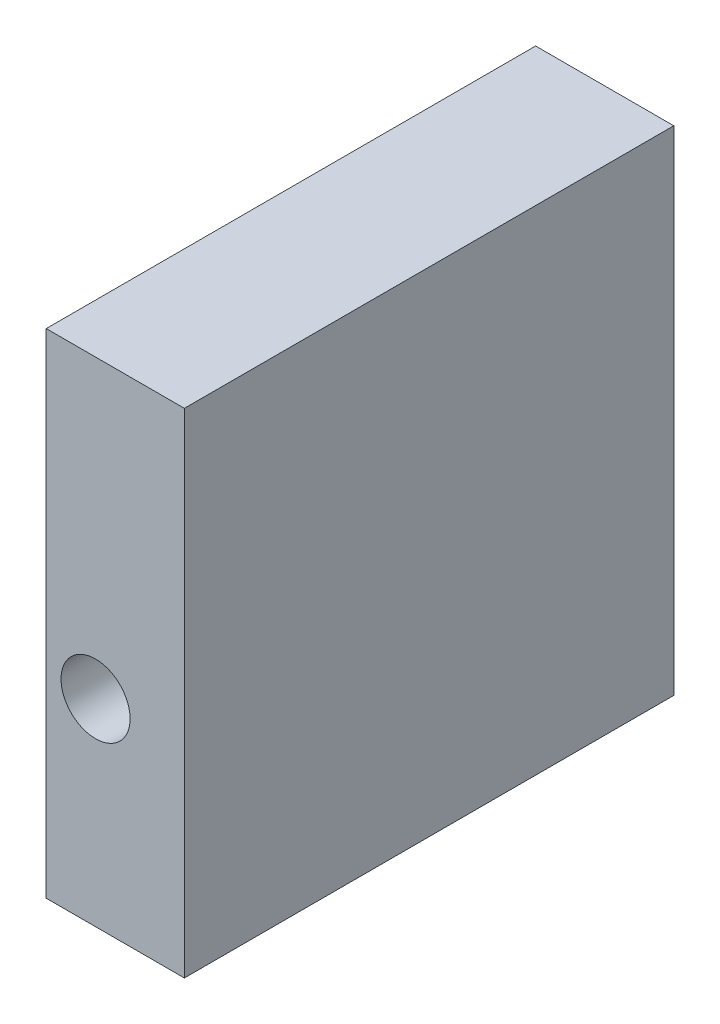
from build123d import *

# Parameters (mm, degrees)
SKETCH1_W           = 7
SKETCH1_H           = 25
BOSS_EXTRUDE1_DEPTH = 24.8
SKETCH2_R           = 1.75
CUT_EXTRUDE1_DEPTH  = 109.095716853


with BuildPart() as part:
    # Sketch1 → Boss-Extrude1 (new body)
    with BuildSketch(Plane.XY):
        with Locations((64.704976365, -67.610705908)):
            Rectangle(SKETCH1_W, SKETCH1_H)
    extrude(amount=BOSS_EXTRUDE1_DEPTH)

    # Sketch2 → Cut-Extrude1 (cut, through all)
    with BuildSketch(Plane.XY.offset(24.8)):
        with Locations((63.704976365, -70.110705908)):
            Circle(SKETCH2_R)
        with Locations((63.704976365, -90.110705908)):
            Circle(SKETCH2_R)
    extrude(amount=-CUT_EXTRUDE1_DEPTH, mode=Mode.SUBTRACT)


solid = part.part
